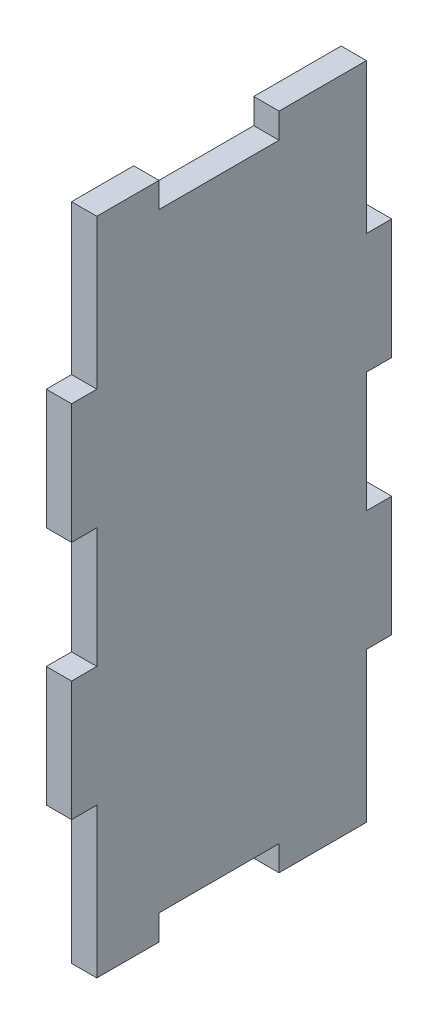
from build123d import *

# Parameters (mm, degrees)
BOSS_EXTRUDE1_DEPTH = 3


with BuildPart() as part:
    # Sketch1 → Boss-Extrude1 (new body)
    with BuildSketch(Plane(origin=(0, 0, 0), x_dir=(0, 0, -1), z_dir=(1, 0, 0))):
        Polygon((-16.71972375, 37.329355417), (-16.71972375, 19.554355417), (-19.71972375, 19.554355417), (-19.71972375, 5.304355417), (-16.71972375, 5.304355417), (-16.71972375, -8.945644583), (-19.71972375, -8.945644583), (-19.71972375, -23.195644583), (-16.71972375, -23.195644583), (-16.71972375, -37.445644583), (-16.71972375, -40.970644583), (-9.34472375, -40.970644583), (-9.34472375, -37.970644583), (4.90527625, -37.970644583), (4.90527625, -40.970644583), (15.28027625, -40.970644583), (15.28027625, -23.195644583), (18.28027625, -23.195644583), (18.28027625, -8.945644583), (15.28027625, -8.945644583), (15.28027625, 5.304355417), (18.28027625, 5.304355417), (18.28027625, 19.554355417), (15.28027625, 19.554355417), (15.28027625, 33.804355417), (15.28027625, 37.329355417), (4.90527625, 37.329355417), (4.90527625, 34.329355417), (-9.34472375, 34.329355417), (-9.34472375, 37.329355417), align=None)
    extrude(amount=BOSS_EXTRUDE1_DEPTH)


solid = part.part
